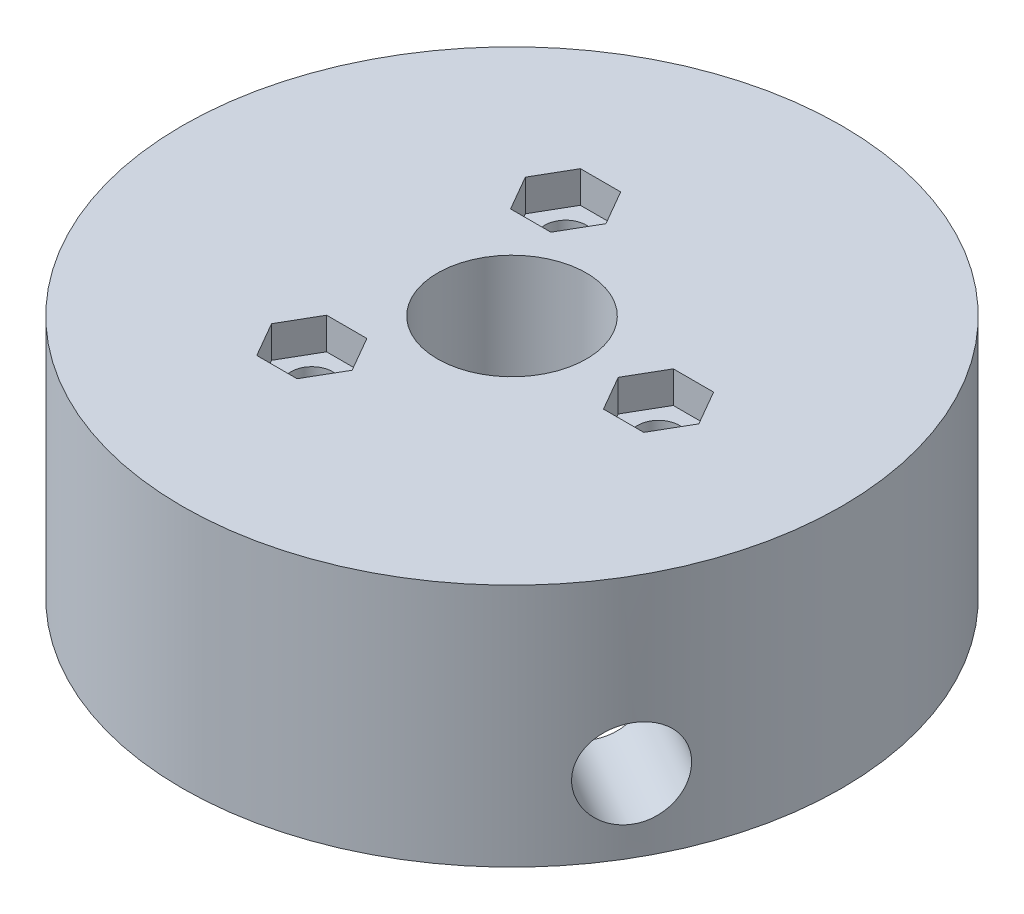
from build123d import *

# Parameters (mm, degrees)
TYRE_SEAT_BLANK_SKETCH_R        = 27
TYRE_SEAT_BLANK_DEPTH           = 20
AXLE_CLEARANCE_SKETCH_R         = 6.1
AXLE_CLEARANCE_DEPTH            = 20.2
HUB_NECK_SOCKET_SKETCH_R        = 9.2
HUB_NECK_SOCKET_DEPTH           = 10.5
HUB_FLANGE_SOCKET_SKETCH_R      = 18.2
HUB_FLANGE_SOCKET_DEPTH         = 3.5
RIM_BOLT_PATTERN_SKETCH_R       = 1.7
RIM_BOLT_PATTERN_DEPTH          = 20.2
RIM_NUT_POCKETS_DEPTH           = 2.7
HUB_PIN_SERVICE_WINDOW_SKETCH_R = 3.6
HUB_PIN_SERVICE_WINDOW_DEPTH    = 56


with BuildPart() as part:
    # Tyre seat blank sketch → Tyre seat blank (new body)
    with BuildSketch(Plane(origin=(0, -283, 0), x_dir=(1, 0, 0), z_dir=(0, 1, 0))):
        with Locations(Location((-19.009182883, 53.244882879, 0), (0, 0, 270))):
            Circle(TYRE_SEAT_BLANK_SKETCH_R)
    extrude(amount=TYRE_SEAT_BLANK_DEPTH)

    # Axle clearance sketch → Axle clearance (cut)
    with BuildSketch(Plane(origin=(0, -283.1, 0), x_dir=(1, 0, 0), z_dir=(0, 1, 0))):
        with Locations(Location((-19.009182883, 53.244882879, 0), (0, 0, 270))):
            Circle(AXLE_CLEARANCE_SKETCH_R)
    extrude(amount=AXLE_CLEARANCE_DEPTH, mode=Mode.SUBTRACT)

    # Hub neck socket sketch → Hub neck socket (cut)
    with BuildSketch(Plane(origin=(0, -273.3, 0), x_dir=(1, 0, 0), z_dir=(0, 1, 0))):
        with Locations(Location((-19.009182883, 53.244882879, 0), (0, 0, 90))):
            Circle(HUB_NECK_SOCKET_SKETCH_R)
    extrude(amount=HUB_NECK_SOCKET_DEPTH, mode=Mode.SUBTRACT)

    # Hub flange socket sketch → Hub flange socket (cut)
    with BuildSketch(Plane(origin=(0, -266.3, 0), x_dir=(1, 0, 0), z_dir=(0, 1, 0))):
        with Locations(Location((-19.009182883, 53.244882879, 0), (0, 0, 270))):
            Circle(HUB_FLANGE_SOCKET_SKETCH_R)
    extrude(amount=HUB_FLANGE_SOCKET_DEPTH, mode=Mode.SUBTRACT)

    # Rim bolt pattern sketch → Rim bolt pattern (cut)
    with BuildSketch(Plane(origin=(0, -283.1, 0), x_dir=(1, 0, 0), z_dir=(0, 1, 0))):
        with Locations(Location((-7.009182883, 53.244882879, 0), (0, 0, 270))):
            Circle(RIM_BOLT_PATTERN_SKETCH_R)
        with Locations(Location((-25.009182883, 42.852578033, 0), (0, 0, 270))):
            Circle(RIM_BOLT_PATTERN_SKETCH_R)
        with Locations(Location((-25.009182883, 63.637187724, 0), (0, 0, 270))):
            Circle(RIM_BOLT_PATTERN_SKETCH_R)
    extrude(amount=RIM_BOLT_PATTERN_DEPTH, mode=Mode.SUBTRACT)

    # Rim nut pockets sketch → Rim nut pockets (cut)
    with BuildSketch(Plane(origin=(0, -283.1, 0), x_dir=(1, 0, 0), z_dir=(0, 1, 0))):
        Polygon((-3.709182883, 53.244882879), (-5.359182883, 56.102766711), (-8.659182883, 56.102766711), (-10.309182883, 53.244882879), (-8.659182883, 50.386999046), (-5.359182883, 50.386999046), align=None)
        Polygon((-21.709182883, 42.852578033), (-23.359182883, 45.710461866), (-26.659182883, 45.710461866), (-28.309182883, 42.852578033), (-26.659182883, 39.994694201), (-23.359182883, 39.994694201), align=None)
        Polygon((-21.709182883, 63.637187724), (-23.359182883, 66.495071557), (-26.659182883, 66.495071557), (-28.309182883, 63.637187724), (-26.659182883, 60.779303892), (-23.359182883, 60.779303892), align=None)
    extrude(amount=RIM_NUT_POCKETS_DEPTH, mode=Mode.SUBTRACT)

    # Hub pin service window sketch → Hub pin service window (cut)
    with BuildSketch(Plane(origin=(-61.561309066, 0, -35.542438361), x_dir=(0.4999999999999994, 0, -0.866025403784439), z_dir=(0.866025403784439, 0, 0.4999999999999994))):
        with Locations(Location((36.606829753, -269, 0), (0, 0, 180))):
            Circle(HUB_PIN_SERVICE_WINDOW_SKETCH_R)
    extrude(amount=HUB_PIN_SERVICE_WINDOW_DEPTH, mode=Mode.SUBTRACT)


with BuildPart() as body_2:
    # Mirror1: mirrored copy
    add(part.part.mirror(Plane(origin=(0, 0, 0), x_dir=(0, 0, 1), z_dir=(0, -1, 0))))


solid = body_2.part
